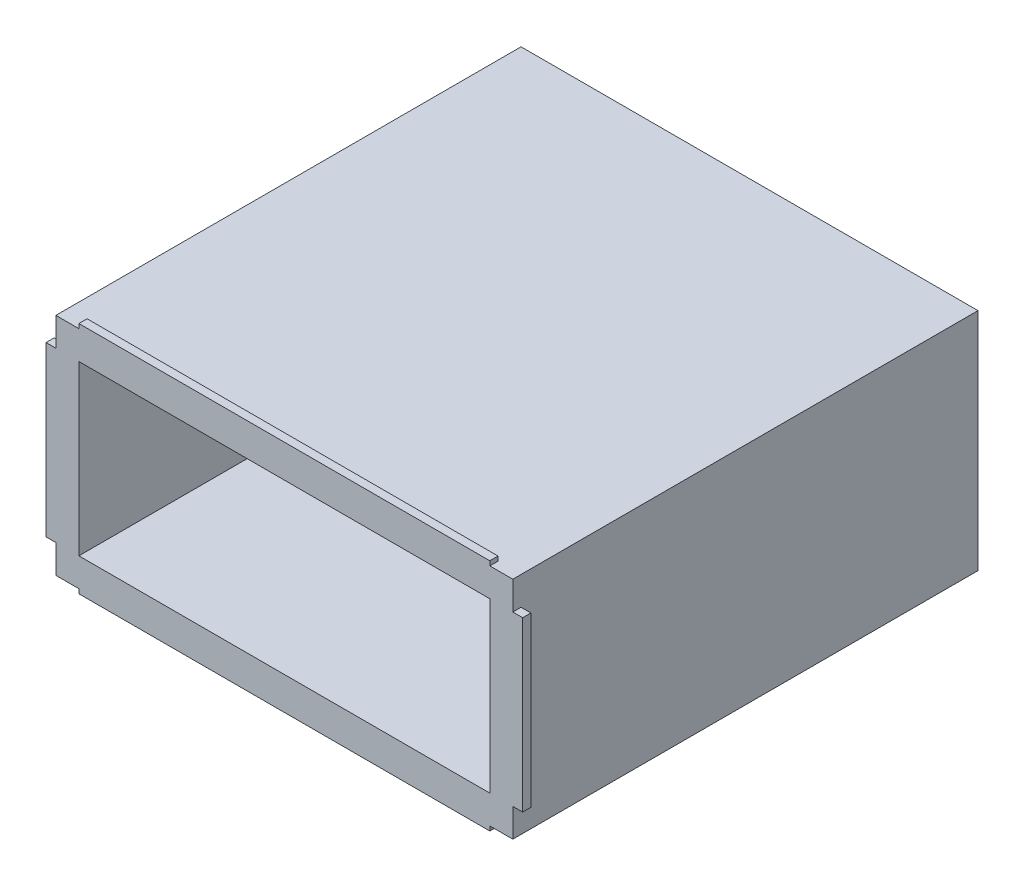
from build123d import *

# Parameters (mm, degrees)
SKETCH1_W           = 13.9
SKETCH1_H           = 6.85
BOSS_EXTRUDE1_DEPTH = 14.15
SKETCH2_W           = 12.5
SKETCH2_H           = 5.12
CUT_EXTRUDE1_DEPTH  = 13
SKETCH4_W           = 12.5
SKETCH4_H           = 0.25
BOSS_EXTRUDE2_DEPTH = 0.135
SKETCH5_W           = 0.25
SKETCH5_H           = 5.12
BOSS_EXTRUDE3_DEPTH = 0.3


with BuildPart() as part:
    # Sketch1 → Boss-Extrude1 (new body)
    with BuildSketch(Plane.XY):
        Rectangle(SKETCH1_W, SKETCH1_H)
    extrude(amount=BOSS_EXTRUDE1_DEPTH)

    # Sketch2 → Cut-Extrude1 (cut)
    with BuildSketch(Plane.XY.offset(14.15)):
        Rectangle(SKETCH2_W, SKETCH2_H)
    extrude(amount=-CUT_EXTRUDE1_DEPTH, mode=Mode.SUBTRACT)

    # Sketch4 → Boss-Extrude2 (add)
    with BuildSketch(Plane(origin=(0, 3.425, 0), x_dir=(1, 0, 0), z_dir=(0, 1, 0))):
        with Locations((0, -14.025)):
            Rectangle(SKETCH4_W, SKETCH4_H)
    boss_extrude2 = extrude(amount=BOSS_EXTRUDE2_DEPTH)

    # Mirror1: Boss-Extrude2 across plane
    add(boss_extrude2.mirror(Plane.ZX))

    # Sketch5 → Boss-Extrude3 (add)
    with BuildSketch(Plane(origin=(6.95, 0, 0), x_dir=(0, 0, -1), z_dir=(1, 0, 0))):
        with Locations((-14.025, 0)):
            Rectangle(SKETCH5_W, SKETCH5_H)
    boss_extrude3 = extrude(amount=BOSS_EXTRUDE3_DEPTH)

    # Mirror2: Boss-Extrude3 across plane
    add(boss_extrude3.mirror(Plane(origin=(0, 0, 0), x_dir=(0, 0, 1), z_dir=(1, 0, 0))))


solid = part.part
